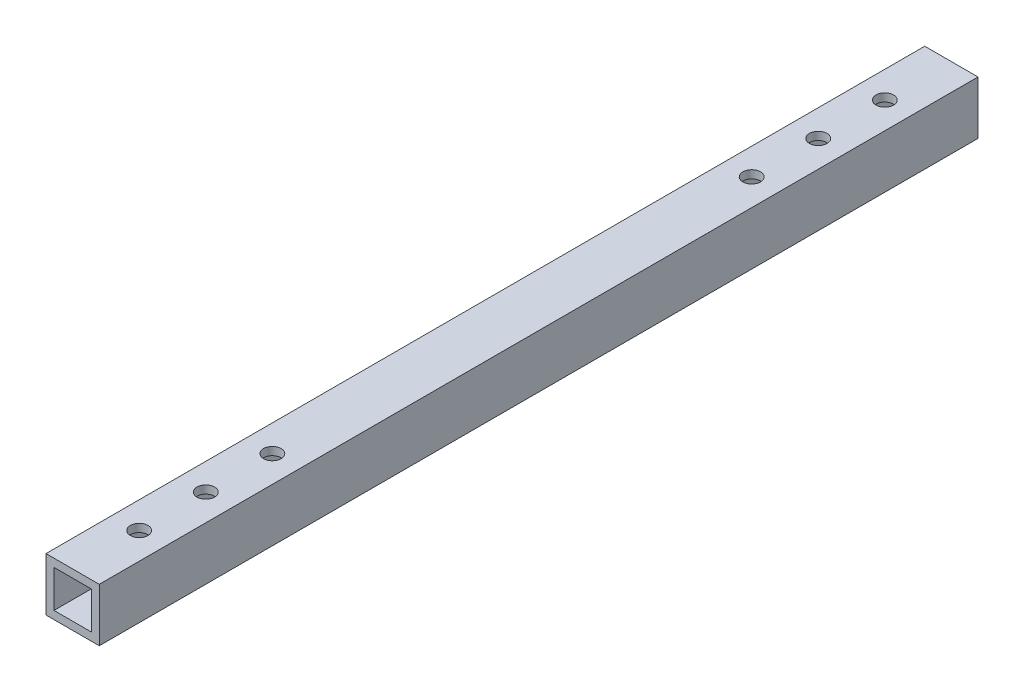
from build123d import *

# Parameters (mm, degrees)
SKETCH_1_W          = 10
SKETCH_1_H          = 10
SKETCH_1_W_2        = 7
SKETCH_1_H_2        = 7
EXTRUDE_1_DEPTH     = 165
SKETCH_2_R          = 1.65
CUT_EXTRUDE_1_DEPTH = 166.378354085


with BuildPart() as part:
    # 草图1 → 凸台-拉伸1 (new body)
    with BuildSketch(Plane.XY):
        Rectangle(SKETCH_1_W, SKETCH_1_H)
        Rectangle(SKETCH_1_W_2, SKETCH_1_H_2, mode=Mode.SUBTRACT)
    extrude(amount=EXTRUDE_1_DEPTH)

    # 草图2 → 切除-拉伸1 (cut, through all)
    with BuildSketch(Plane(origin=(0, 5, 0), x_dir=(1, 0, 0), z_dir=(0, 1, 0))):
        with Locations(Location((0, -12.5, 0), (0, 0, 270))):
            Circle(SKETCH_2_R)
        with Locations(Location((0, -25, 0), (0, 0, 270))):
            Circle(SKETCH_2_R)
        with Locations(Location((0, -37.5, 0), (0, 0, 270))):
            Circle(SKETCH_2_R)
        with Locations(Location((0, -127.5, 0), (0, 0, 270))):
            Circle(SKETCH_2_R)
        with Locations(Location((0, -140, 0), (0, 0, 270))):
            Circle(SKETCH_2_R)
        with Locations(Location((0, -152.5, 0), (0, 0, 270))):
            Circle(SKETCH_2_R)
    extrude(amount=-CUT_EXTRUDE_1_DEPTH, mode=Mode.SUBTRACT)


solid = part.part
